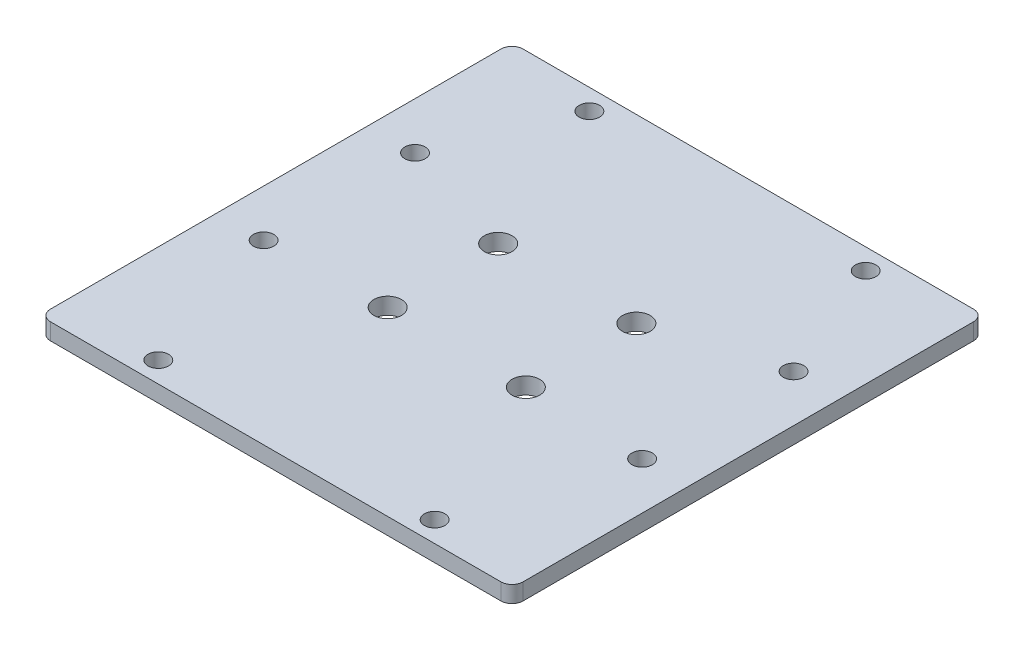
from build123d import *

# Parameters (mm, degrees)
SKETCH1_W           = 85.5
SKETCH1_H           = 85.5
BOSS_EXTRUDE1_DEPTH = 3
FILLET1_R           = 2
SKETCH3_R           = 1.85
CUT_EXTRUDE1_DEPTH  = 10
SKETCH4_R           = 2.5
SKETCH4_R_2         = 1.85
CUT_EXTRUDE2_DEPTH  = 10


with BuildPart() as part:
    # Sketch1 → Boss-Extrude1 (new body)
    with BuildSketch(Plane(origin=(0, 0, 0), x_dir=(1, 0, 0), z_dir=(0, 1, 0))):
        Rectangle(SKETCH1_W, SKETCH1_H)
    extrude(amount=BOSS_EXTRUDE1_DEPTH)

    # Fillet1
    fillet1_edges = [part.edges().sort_by_distance(p)[0] for p in [
        (-42.75, 1.5, -42.75),
        (42.75, 1.5, -42.75),
        (42.75, 1.5, 42.75),
        (-42.75, 1.5, 42.75),
    ]]
    fillet(fillet1_edges, radius=FILLET1_R)

    # Sketch3 → Cut-Extrude1 (cut)
    with BuildSketch(Plane(origin=(0, 3, 0), x_dir=(1, 0, 0), z_dir=(0, 1, 0))):
        with Locations(Location((-25, 39, 0), (0, 0, 270))):
            Circle(SKETCH3_R)
        with Locations(Location((25, 39, 0), (0, 0, 270))):
            Circle(SKETCH3_R)
        with Locations(Location((25, -39, 0), (0, 0, 270))):
            Circle(SKETCH3_R)
        with Locations(Location((-25, -39, 0), (0, 0, 270))):
            Circle(SKETCH3_R)
    extrude(amount=-CUT_EXTRUDE1_DEPTH, mode=Mode.SUBTRACT)

    # Sketch4 → Cut-Extrude2 (cut)
    with BuildSketch(Plane(origin=(0, 3, 0), x_dir=(1, 0, 0), z_dir=(0, 1, 0))):
        with Locations(Location((-12.5, 10, 0), (0, 0, 270))):
            Circle(SKETCH4_R)
        with Locations(Location((-12.5, -10, 0), (0, 0, 270))):
            Circle(SKETCH4_R)
        with Locations(Location((12.5, 10, 0), (0, 0, 270))):
            Circle(SKETCH4_R)
        with Locations(Location((12.5, -10, 0), (0, 0, 270))):
            Circle(SKETCH4_R)
        with Locations(Location((-34.25, 16.7, 0), (0, 0, 270))):
            Circle(SKETCH4_R_2)
        with Locations(Location((-34.25, -10.7, 0), (0, 0, 270))):
            Circle(SKETCH4_R_2)
        with Locations(Location((34.25, -10.7, 0), (0, 0, 270))):
            Circle(SKETCH4_R_2)
        with Locations(Location((34.25, 16.7, 0), (0, 0, 270))):
            Circle(SKETCH4_R_2)
    extrude(amount=-CUT_EXTRUDE2_DEPTH, mode=Mode.SUBTRACT)


solid = part.part
